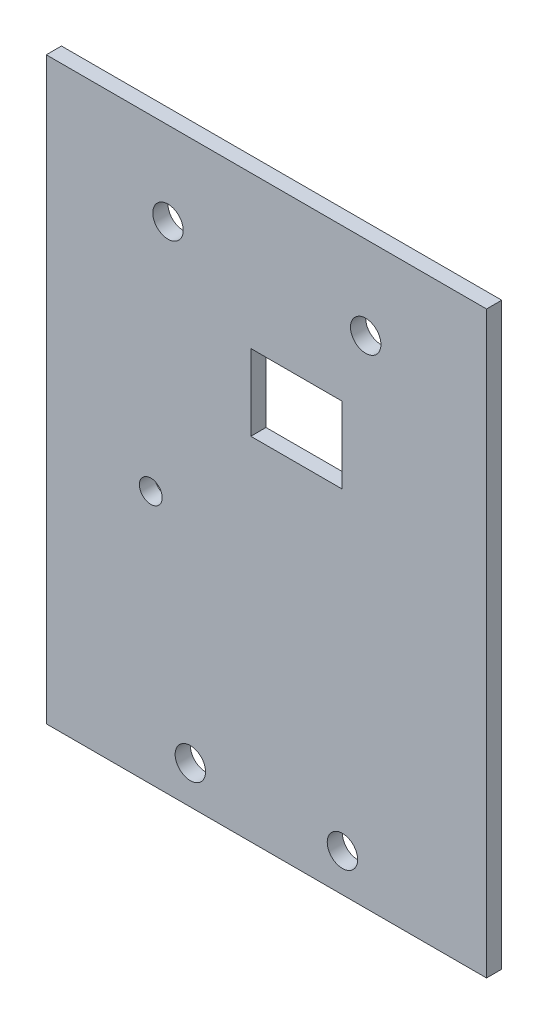
from build123d import *

# Parameters (mm, degrees)
SKETCH1_W           = 57.9
SKETCH1_H           = 76.2
BOSS_EXTRUDE1_DEPTH = 2
SKETCH2_R           = 2
SKETCH2_W           = 12
SKETCH2_H           = 10
SKETCH2_R_2         = 1.5
CUT_EXTRUDE1_DEPTH  = 2
SKETCH4_R           = 2
SKETCH4_R_2         = 1.5
SKETCH4_R_3         = 1.957178151
BOSS_EXTRUDE5_DEPTH = 2
SKETCH8_W           = 57.9
SKETCH8_H           = 76.2
SKETCH8_R           = 2
SKETCH8_R_2         = 1.5
SKETCH8_W_2         = 12
SKETCH8_H_2         = 10
BOSS_EXTRUDE6_DEPTH = 10
SKETCH9_R           = 2
CUT_EXTRUDE6_DEPTH  = 10
SKETCH10_W          = 57.9
SKETCH10_H          = 76.2
CUT_EXTRUDE7_DEPTH  = 10


with BuildPart() as part:
    # Sketch1 → Boss-Extrude1 (new body)
    with BuildSketch(Plane.XY):
        with Locations((-6.590392234, -8.896581688)):
            Rectangle(SKETCH1_W, SKETCH1_H)
    extrude(amount=BOSS_EXTRUDE1_DEPTH)

    # Sketch2 → Cut-Extrude1 (cut)
    with BuildSketch(Plane(origin=(0, 0, 0), x_dir=(-1, 0, 0), z_dir=(0, 0, -1))):
        with Locations((-6.409607766, 14.203418312)):
            Circle(SKETCH2_R)
        with Locations((19.590392234, 14.203418312)):
            Circle(SKETCH2_R)
        with Locations((2.640392234, 4.203418312)):
            Rectangle(SKETCH2_W, SKETCH2_H)
        with Locations((16.590392234, -41.996581688)):
            Circle(SKETCH2_R)
        with Locations((-3.409607766, -41.996581688)):
            Circle(SKETCH2_R)
        with Locations((21.790392234, -13.626581688)):
            Circle(SKETCH2_R_2)
    extrude(amount=-CUT_EXTRUDE1_DEPTH, mode=Mode.SUBTRACT)

    # Sketch4 → Boss-Extrude5 (add)
    # profile 1 of 3: a face of its own
    with BuildSketch(Plane(origin=(0, 0, 0), x_dir=(-1, 0, 0), z_dir=(0, 0, -1))):
        Polygon((35.540392234, 29.203418312), (6.590392234, 29.203418312), (-22.359607766, 29.203418312), (-22.359607766, -46.996581688), (35.540392234, -46.996581688), align=None)
        with Locations((-3.409607766, -41.996581688)):
            Circle(SKETCH4_R, mode=Mode.SUBTRACT)
        with Locations((16.590392234, -41.996581688)):
            Circle(SKETCH4_R, mode=Mode.SUBTRACT)
        with Locations((21.790392234, -13.626581688)):
            Circle(SKETCH4_R_2, mode=Mode.SUBTRACT)
        Polygon((-13.650237399, 24.487372027), (6.590392234, 24.487372027), (30.150370064, 24.487372027), (30.150370064, 9.203418312), (8.640392234, 9.203418312), (8.640392234, -0.796581688), (-3.359607766, -0.796581688), (-3.359607766, 9.203418312), (-13.650237399, 9.203418312), align=None, mode=Mode.SUBTRACT)
    # profile 2 of 3: a face of its own
    with BuildSketch(Plane(origin=(0, 0, 0), x_dir=(-1, 0, 0), z_dir=(0, 0, -1))):
        with Locations((-6.409607766, 14.203418312)):
            Circle(SKETCH4_R)
    # profile 3 of 3: a face of its own
    with BuildSketch(Plane(origin=(0, 0, 0), x_dir=(-1, 0, 0), z_dir=(0, 0, -1))):
        with Locations((19.590392234, 14.203418312)):
            Circle(SKETCH4_R_3)
    extrude(amount=-BOSS_EXTRUDE5_DEPTH)


with BuildPart() as boss_extrude5_piece_1:
    # of the separate pieces the step leaves, piece 1, a body of its own (boss_extrude5_pieces)
    add(part.part.solids().sort_by_distance((-35.540392234, 29.203418312, 0))[0])



with BuildPart() as boss_extrude5_piece_2:
    # of the separate pieces the step leaves, piece 2, a body of its own (boss_extrude5_pieces)
    add(part.part.solids().sort_by_distance((-21.547570385, 14.203418312, 0))[0])


with BuildPart() as boss_extrude5_piece_1_1:
    add(boss_extrude5_piece_1.part)

    add(boss_extrude5_piece_2.part)  # Boss-Extrude6 merges Boss-Extrude5 piece 2
    # Sketch8 → Boss-Extrude6 (add)
    # profile 1 of 2: a face of its own
    with BuildSketch(Plane(origin=(0, 0, 0), x_dir=(-1, 0, 0), z_dir=(0, 0, -1))):
        with Locations((6.590392234, -8.896581688)):
            Rectangle(SKETCH8_W, SKETCH8_H)
        with Locations((16.590392234, -41.996581688)):
            Circle(SKETCH8_R, mode=Mode.SUBTRACT)
        with Locations((21.790392234, -13.626581688)):
            Circle(SKETCH8_R_2, mode=Mode.SUBTRACT)
        with Locations((19.590392234, 14.203418312)):
            Circle(SKETCH8_R, mode=Mode.SUBTRACT)
        with Locations((-3.409607766, -41.996581688)):
            Circle(SKETCH8_R, mode=Mode.SUBTRACT)
        with Locations((2.640392234, 4.203418312)):
            Rectangle(SKETCH8_W_2, SKETCH8_H_2, mode=Mode.SUBTRACT)
    # profile 2 of 2: a face of its own
    with BuildSketch(Plane(origin=(0, 0, 0), x_dir=(-1, 0, 0), z_dir=(0, 0, -1))):
        with Locations((19.590392234, 14.203418312)):
            Circle(SKETCH8_R)
    extrude(amount=BOSS_EXTRUDE6_DEPTH)

    # Sketch9 → Cut-Extrude6 (cut)
    with BuildSketch(Plane(origin=(0, 0, -10), x_dir=(-1, 0, 0), z_dir=(0, 0, -1))):
        with Locations((-6.468155069, 18.203418312)):
            Circle(SKETCH9_R)
        with Locations((19.531844931, 18.203418312)):
            Circle(SKETCH9_R)
    extrude(amount=-CUT_EXTRUDE6_DEPTH, mode=Mode.SUBTRACT)

    # Sketch10 → Cut-Extrude7 (cut)
    with BuildSketch(Plane.XY.offset(2)):
        with Locations((-6.590392234, -8.896581688)):
            Rectangle(SKETCH10_W, SKETCH10_H)
    extrude(amount=-CUT_EXTRUDE7_DEPTH, mode=Mode.SUBTRACT)


solid = boss_extrude5_piece_1_1.part
